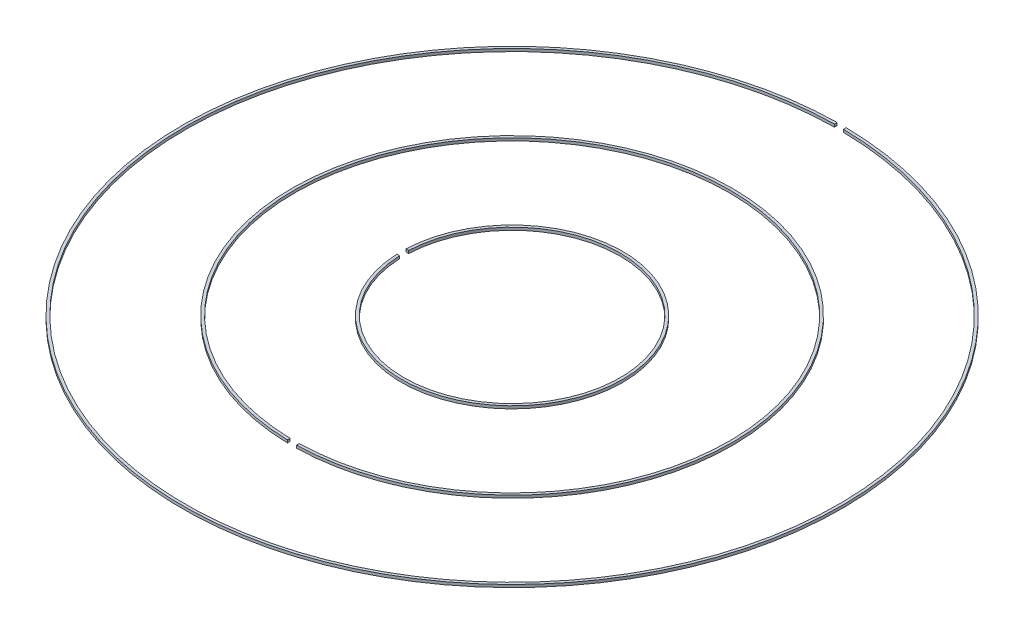
from build123d import *

# Parameters (mm, degrees)
BOSS_EXTRUDE1_DEPTH   = 0.036
BOSS_EXTRUDE1_2_DEPTH = 0.036
BOSS_EXTRUDE1_3_DEPTH = 0.036


with BuildPart() as part:
    # Sketch1 → Boss-Extrude1 (new body)
    with BuildSketch(Plane(origin=(0, 0, 0), x_dir=(1, 0, 0), z_dir=(0, 1, 0))):
        with BuildLine():
            Line((0.06, 4.38258931), (0.06, 4.346585909))
            ThreePointArc((0.06, 4.346585909), (0, -4.347000007), (-0.06, 4.346585909))
            Line((-0.06, 4.346585909), (-0.06, 4.38258931))
            ThreePointArc((-0.06, 4.38258931), (0, -4.383000007), (0.06, 4.38258931))
        make_face()
    extrude(amount=BOSS_EXTRUDE1_DEPTH)


with BuildPart() as body_2:
    # Sketch1 → Boss-Extrude1 2 (new body)
    with BuildSketch(Plane(origin=(0, 0, 0), x_dir=(1, 0, 0), z_dir=(0, 1, 0))):
        with BuildLine():
            Line((0.06, -2.891379677), (0.06, -2.927383078))
            ThreePointArc((0.06, -2.927383078), (0, 2.927997897), (-0.06, -2.927383078))
            Line((-0.06, -2.927383078), (-0.06, -2.891379677))
            ThreePointArc((-0.06, -2.891379677), (0, 2.89200215), (0.06, -2.891379677))
        make_face()
    extrude(amount=BOSS_EXTRUDE1_2_DEPTH)


with BuildPart() as body_3:
    # Sketch1 → Boss-Extrude1 3 (new body)
    with BuildSketch(Plane(origin=(0, 0, 0), x_dir=(1, 0, 0), z_dir=(0, 1, 0))):
        with BuildLine():
            Line((-1.471764061, 0.06), (-1.435760659, 0.06))
            ThreePointArc((-1.435760659, 0.06), (1.437013803, 0), (-1.435760659, -0.06))
            Line((-1.435760659, -0.06), (-1.471764061, -0.06))
            ThreePointArc((-1.471764061, -0.06), (1.472986575, 0), (-1.471764061, 0.06))
        make_face()
    extrude(amount=BOSS_EXTRUDE1_3_DEPTH)


solid = Compound([part.part, body_2.part, body_3.part])
